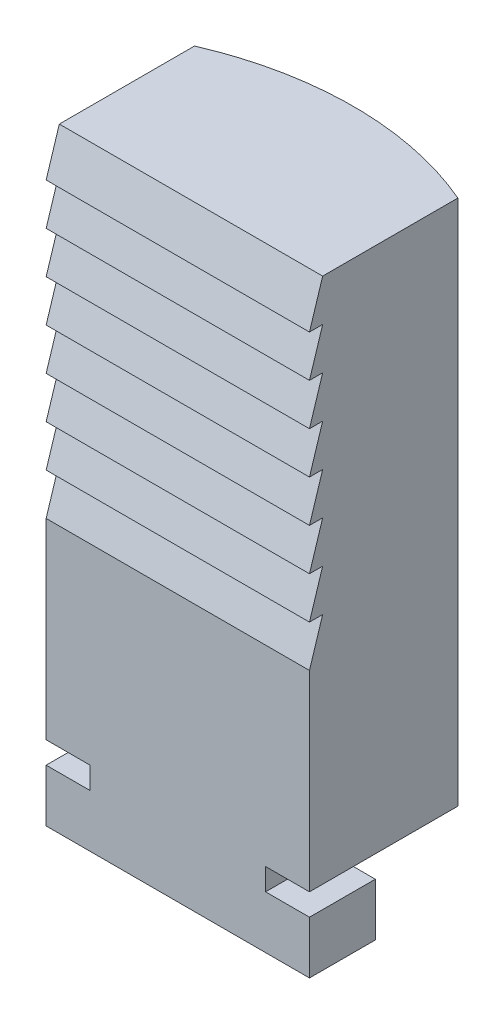
from build123d import *

# Parameters (mm, degrees)
BOSS_EXTRUDE1_DEPTH     = 40
CUT_EXTRUDE1_DEPTH      = 155.819249449
CUT_EXTRUDE1_DEPTH_BACK = 155.819249449
CUT_EXTRUDE2_DEPTH      = 25
CUT_EXTRUDE3_DEPTH      = 155.819249449


with BuildPart() as part:
    # Sketch1 → Boss-Extrude1 (new body)
    with BuildSketch(Plane.XY):
        Polygon((0, 0), (60, 0), (60, 12), (50, 12), (50, 17), (60, 17), (60, 137), (0, 137), (0, 17), (10, 17), (10, 12), (0, 12), align=None)
    extrude(amount=BOSS_EXTRUDE1_DEPTH)

    # Sketch2 → Cut-Extrude1 (cut, two sides: drawn at the far end of the back side and taken through both)
    with BuildSketch(Plane(origin=(0, 0, 0), x_dir=(0, 0, -1), z_dir=(1, 0, 0)).offset(-CUT_EXTRUDE1_DEPTH_BACK)):
        Polygon((-40, 137), (-37, 137), (-40, 127.460607986), (-37, 127.460607986), (-40, 117.921215972), (-37, 117.921215972), (-40, 108.381823957), (-37, 108.381823957), (-40, 98.842431943), (-37, 98.842431943), (-40, 89.303039929), (-37, 89.303039929), (-40, 79.763647915), (-37, 79.763647915), (-40, 70.224255901), (-37, 70.224255901), (-40, 60.684863887), (-47.730210084, 60.684863887), (-47.730210084, 137), align=None)
    extrude(amount=CUT_EXTRUDE1_DEPTH + CUT_EXTRUDE1_DEPTH_BACK, mode=Mode.SUBTRACT)

    # Sketch3 → Cut-Extrude2 (cut)
    with BuildSketch(Plane(origin=(0, 0, 0), x_dir=(-1, 0, 0), z_dir=(0, 0, -1))):
        Polygon((-60, 0), (0, 0), (0, 12), (-10, 12), (-10, 17), (-50, 17), (-50, 12), (-60, 12), align=None)
    extrude(amount=-CUT_EXTRUDE2_DEPTH, mode=Mode.SUBTRACT)

    # Sketch4 → Cut-Extrude3 (cut, through all)
    with BuildSketch(Plane(origin=(0, 137, 0), x_dir=(1, 0, 0), z_dir=(0, 1, 0))):
        with BuildLine():
            Line((0, -6.193777394), (0, 6.02263776))
            Line((0, 6.02263776), (60, 6.02263776))
            Line((60, 6.02263776), (60, -6.193777394))
            ThreePointArc((60, -6.193777394), (30, 0), (0, -6.193777394))
        make_face()
    extrude(amount=-CUT_EXTRUDE3_DEPTH, mode=Mode.SUBTRACT)


solid = part.part
